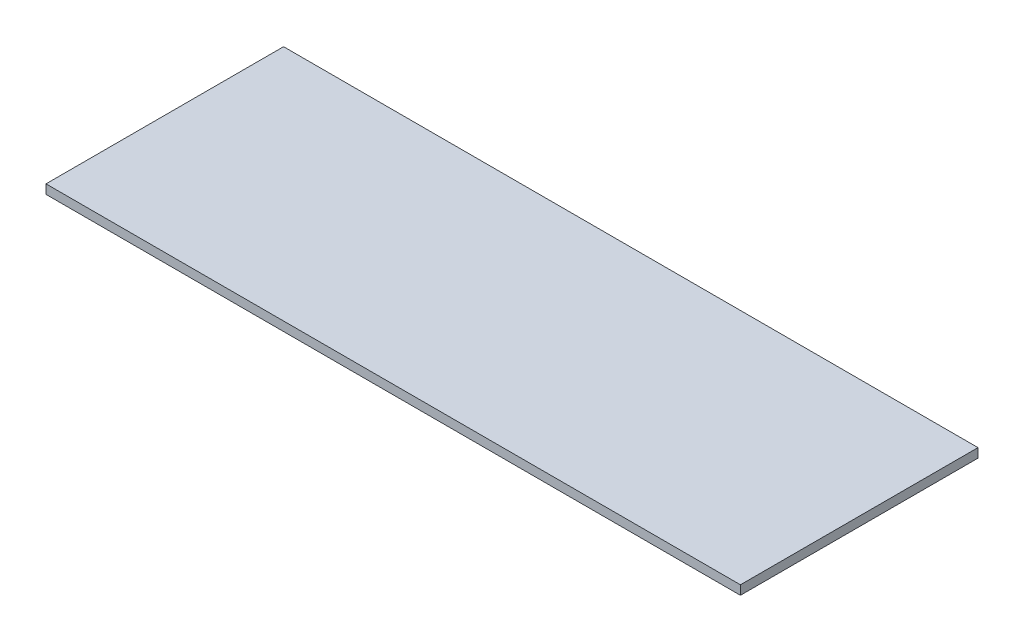
from build123d import *

# Parameters (mm, degrees)
SKETCH1_W           = 76
SKETCH1_H           = 26
BOSS_EXTRUDE1_DEPTH = 1


with BuildPart() as part:
    # Sketch1 → Boss-Extrude1 (new body)
    with BuildSketch(Plane(origin=(0, 0, 0), x_dir=(1, 0, 0), z_dir=(0, 1, 0))):
        with Locations((-1.119842829, 3.349705305)):
            Rectangle(SKETCH1_W, SKETCH1_H)
    extrude(amount=BOSS_EXTRUDE1_DEPTH)


solid = part.part
